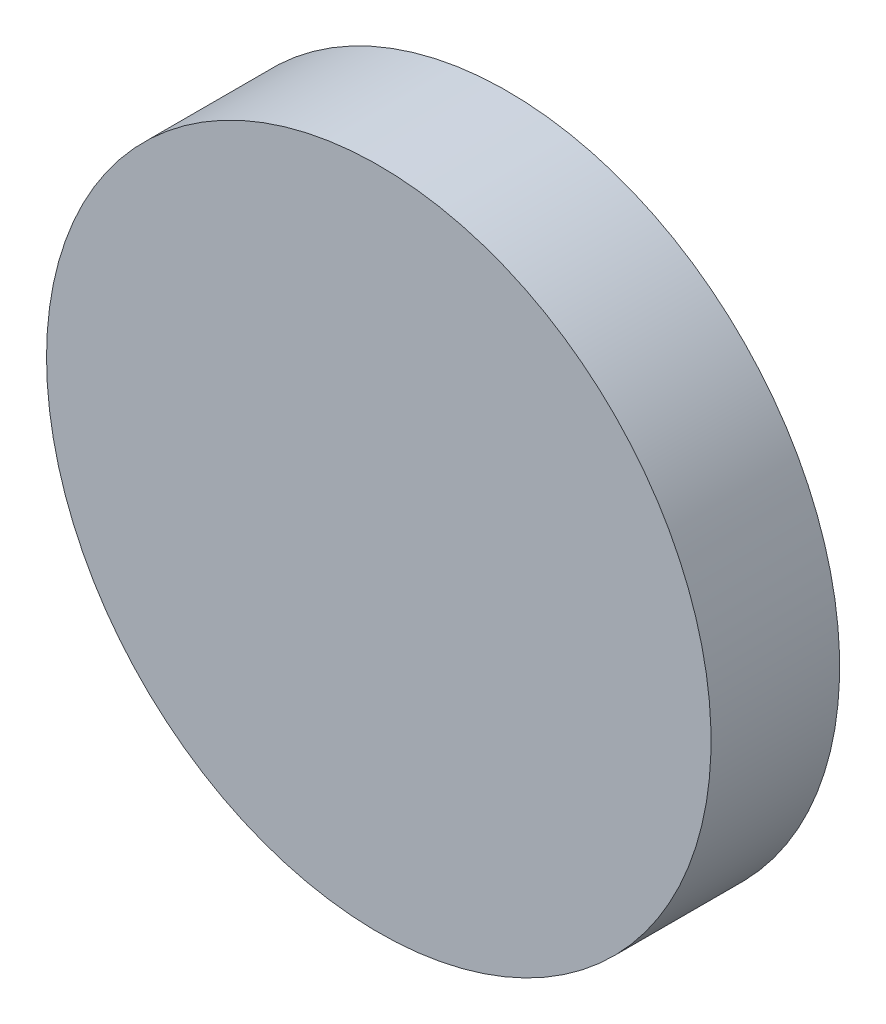
from build123d import *

# Parameters (mm, degrees)
SKETCH1_R           = 78.74
BOSS_EXTRUDE1_DEPTH = 30.48


with BuildPart() as part:
    # Sketch1 → Boss-Extrude1 (new body)
    with BuildSketch(Plane.XY):
        with Locations(Location((0, 0, 0), (0, 0, 180))):
            Circle(SKETCH1_R)
    extrude(amount=BOSS_EXTRUDE1_DEPTH)


solid = part.part
